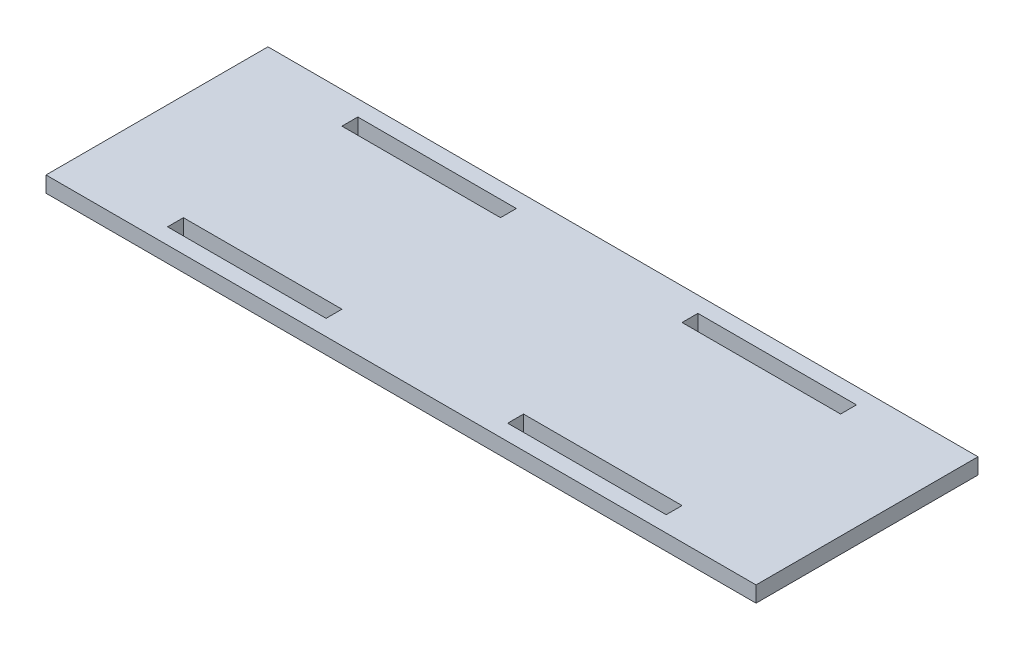
from build123d import *

# Parameters (mm, degrees)
SKETCH1_W           = 134.36
SKETCH1_H           = 42
SKETCH1_W_2         = 30
SKETCH1_H_2         = 3
BOSS_EXTRUDE1_DEPTH = 3


with BuildPart() as part:
    # Sketch1 → Boss-Extrude1 (new body)
    with BuildSketch(Plane(origin=(0, 0, 0), x_dir=(1, 0, 0), z_dir=(0, 1, 0))):
        with Locations((67.18, 21)):
            Rectangle(SKETCH1_W, SKETCH1_H)
        with Locations((35, 4.5)):
            Rectangle(SKETCH1_W_2, SKETCH1_H_2, mode=Mode.SUBTRACT)
        with Locations((99.36, 4.5)):
            Rectangle(SKETCH1_W_2, SKETCH1_H_2, mode=Mode.SUBTRACT)
        with Locations((99.36, 37.5)):
            Rectangle(SKETCH1_W_2, SKETCH1_H_2, mode=Mode.SUBTRACT)
        with Locations((35, 37.5)):
            Rectangle(SKETCH1_W_2, SKETCH1_H_2, mode=Mode.SUBTRACT)
    extrude(amount=BOSS_EXTRUDE1_DEPTH)


solid = part.part
